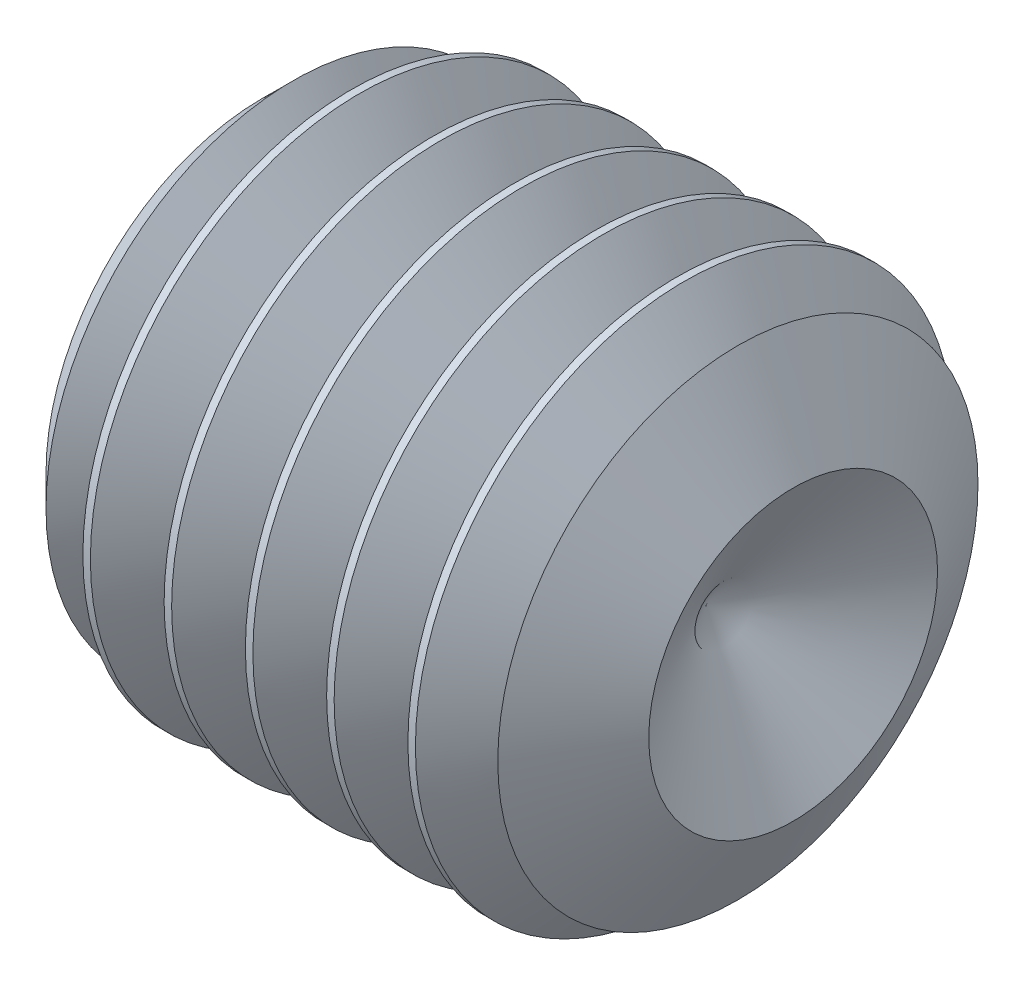
from build123d import *

# Parameters (mm, degrees)
CUT_EXTRUDE1_DEPTH = 2.54


with BuildPart() as part:
    # Sketch1 → Revolve1 (revolve)
    with BuildSketch(Plane(origin=(0, 0, 0), x_dir=(-1, 0, 0), z_dir=(0, 0, -1)), mode=Mode.PRIVATE) as revolve1_sk:
        Polygon((-4.7625, 1.2954), (-3.984145154, 0), (0, 0), (0, 1.94056), (-0.277871959, 2.218431959), (-0.47244, 1.94056), (-0.803246049, 2.413), (-0.870596619, 2.413), (-1.201402668, 1.94056), (-1.532208718, 2.413), (-1.599559287, 2.413), (-1.930365336, 1.94056), (-2.261171385, 2.413), (-2.328521955, 2.413), (-2.659328004, 1.94056), (-2.990134054, 2.413), (-3.057484623, 2.413), (-3.388290672, 1.94056), (-3.719096722, 2.413), (-3.786447291, 2.413), (-4.11725334, 1.94056), (-4.266750263, 2.154063732), align=None)
    revolve(revolve1_sk.sketch.rotate(Axis((4.762525, 0, 0), (-1, 0, 0)), 270), axis=Axis((4.762525, 0, 0), (-1, 0, 0)))

    # Sketch2 → Cut-Extrude1 (cut)
    with BuildSketch(Plane.ZY):
        Polygon((1.374082094, 0), (0.687041047, 1.18999), (-0.687041047, 1.18999), (-1.374082094, 0), (-0.687041047, -1.18999), (0.687041047, -1.18999), align=None)
    extrude(amount=-CUT_EXTRUDE1_DEPTH, mode=Mode.SUBTRACT)


solid = part.part
